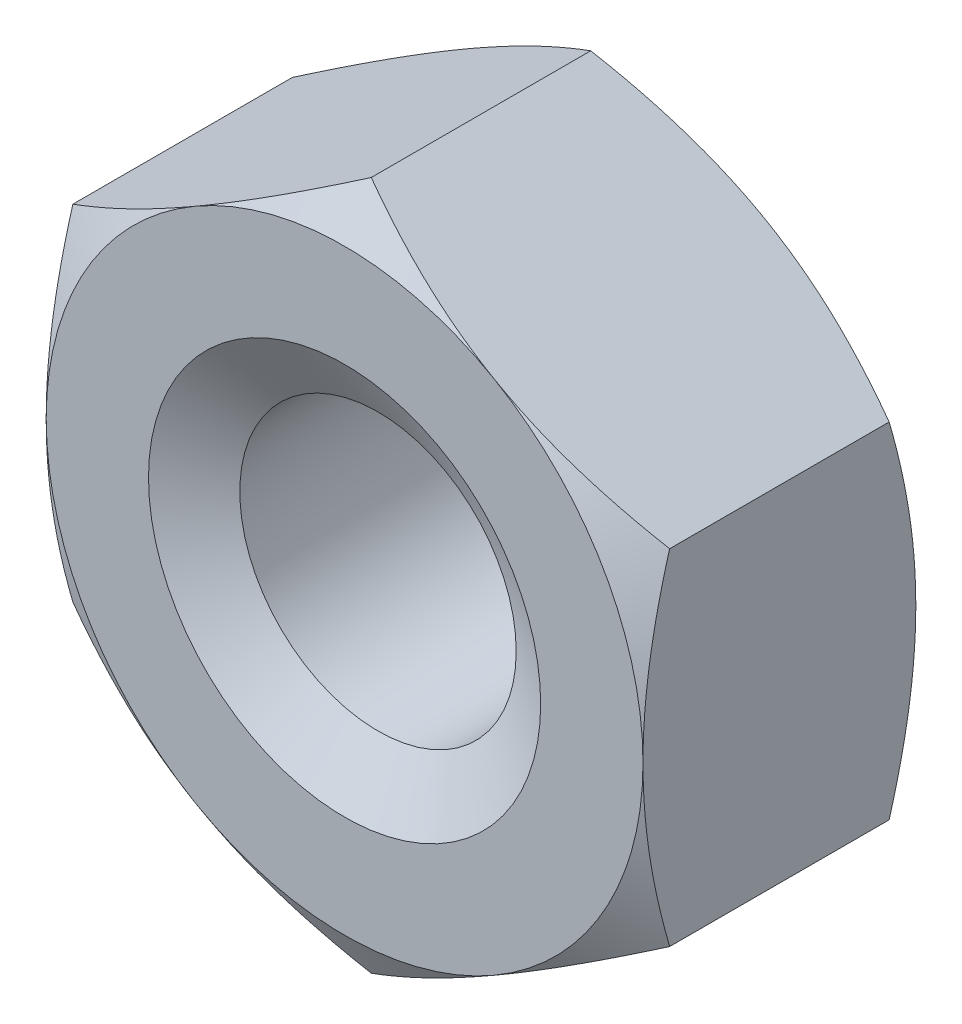
from build123d import *

# Parameters (mm, degrees)
SKETCH_3_R          = 1.621125
EXTRUDE_1_DEPTH     = 3.2
SKETCH_5_R          = 5.745
SKETCH_5_R_2        = 3.5
CUT_EXTRUDE_1_DEPTH = 0.64
CUT_EXTRUDE_1_DRAFT = -60
SKETCH_7_R          = 5.745
SKETCH_7_R_2        = 3.5
CUT_EXTRUDE_2_DEPTH = 0.64
CUT_EXTRUDE_2_DRAFT = -60


with BuildPart() as part:
    # 草图3 → 凸台-拉伸1 (new body)
    with BuildSketch(Plane.XY):
        Polygon((0, 4.041451884), (-3.5, 2.020725942), (-3.5, -2.020725942), (0, -4.041451884), (3.5, -2.020725942), (3.5, 2.020725942), align=None)
        Circle(SKETCH_3_R, mode=Mode.SUBTRACT)
    extrude(amount=-EXTRUDE_1_DEPTH)

    # 草图4 → 切除-旋转1 (revolve, cut)
    with BuildSketch(Plane(origin=(0, 0, 0), x_dir=(0, 0, -1), z_dir=(1, 0, 0)), mode=Mode.PRIVATE) as cut_revolve_1_sk:
        Polygon((0, 2.3), (0.391948664, 1.621125), (0.391948664, 0), (0, 0), align=None)
        Polygon((3.2, 0), (3.2, 2.3), (2.808051336, 1.621125), (2.808051336, 0), align=None)
    revolve(cut_revolve_1_sk.sketch.rotate(Axis((0, 0, 0), (0, 0, -1)), 90), axis=Axis((0, 0, 0), (0, 0, -1)), mode=Mode.SUBTRACT)


with BuildPart() as cut_extrude_1_tool:
    # 草图5 → 切除-拉伸1 (with draft: the straight prism first)
    with BuildSketch(Plane.XY):
        Circle(SKETCH_5_R)
        Circle(SKETCH_5_R_2, mode=Mode.SUBTRACT)
    extrude(amount=-CUT_EXTRUDE_1_DEPTH)
    # 切除-拉伸1: the draft: its side faces are tilted about the plane it starts from
    cut_extrude_1_sides = [cut_extrude_1_tool.faces().sort_by_distance(p)[0] for p in [
        (-5.745, 0, -0.32),
        (-3.5, 0, -0.32),
    ]]
    draft(cut_extrude_1_sides, Plane.XY, CUT_EXTRUDE_1_DRAFT)


with BuildPart() as part_1:
    add(part.part)

    # 切除-拉伸1: cut by cut_extrude_1_tool
    add(cut_extrude_1_tool.part, mode=Mode.SUBTRACT)


with BuildPart() as cut_extrude_2_tool:
    # 草图7 → 切除-拉伸2 (with draft: the straight prism first)
    with BuildSketch(Plane(origin=(0, 0, -3.2), x_dir=(-1, 0, 0), z_dir=(0, 0, -1))):
        Circle(SKETCH_7_R)
        Circle(SKETCH_7_R_2, mode=Mode.SUBTRACT)
    extrude(amount=-CUT_EXTRUDE_2_DEPTH)
    # 切除-拉伸2: the draft: its side faces are tilted about the plane it starts from
    cut_extrude_2_sides = [cut_extrude_2_tool.faces().sort_by_distance(p)[0] for p in [
        (5.745, 0, -2.88),
        (3.5, 0, -2.88),
    ]]
    draft(cut_extrude_2_sides, Plane(origin=(0, 0, -3.2), x_dir=(-1, 0, 0), z_dir=(0, 0, -1)), CUT_EXTRUDE_2_DRAFT)


with BuildPart() as part_2:
    add(part_1.part)

    # 切除-拉伸2: cut by cut_extrude_2_tool
    add(cut_extrude_2_tool.part, mode=Mode.SUBTRACT)


solid = part_2.part
